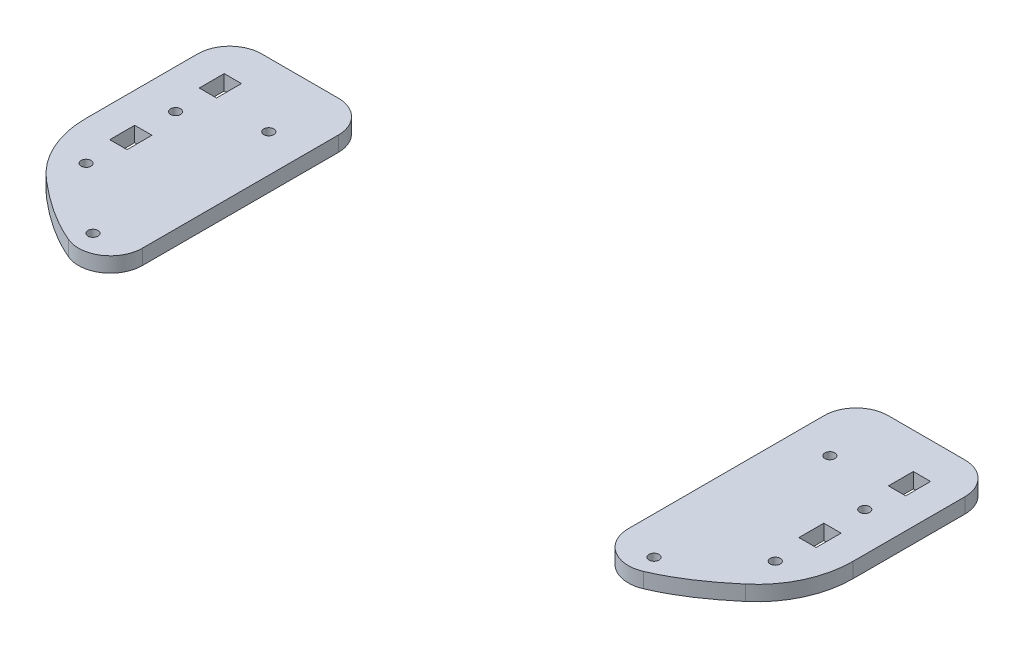
from build123d import *

# Parameters (mm, degrees)
SKETCH1_R        = 1.984375
SKETCH1_W        = 6.858
SKETCH1_H        = 9.906
EXTRUDE1_DEPTH   = 5.9944
EXTRUDE1_2_DEPTH = 5.9944
FILLET1_R        = 12.7
FILLET2_R        = 12.7
FILLET3_R        = 12.7
FILLET5_R        = 12.7
FILLET6_R        = 12.7
FILLET7_R        = 38.1
FILLET8_R        = 38.1
FILLET9_R        = 12.7


with BuildPart() as part:
    # Sketch1 → Extrude1 (new body)
    with BuildSketch(Plane(origin=(0, 0, 0), x_dir=(1, 0, 0), z_dir=(0, 1, 0))):
        with BuildLine():
            Line((38.251531685, 0), (-17.628468315, 0))
            Line((-17.628468315, 0), (-17.628468315, -74.142996555))
            add(Edge.make_bspline(
                [(-17.628468315, -74.142996555), (-7.183046663, -83.85534331), (9.286812039, -99.169323354), (30.494181461, -106.074935248), (38.251531685, -108.600908597)],
                knots=[0, 0, 0, 0, 0.634214406, 1, 1, 1, 1], degree=3))
            Line((38.251531685, -108.600908597), (38.251531685, 0))
        make_face()
        with Locations(Location((23.306531685, -95.25, 0), (0, 0, 270))):
            Circle(SKETCH1_R, mode=Mode.SUBTRACT)
        with Locations(Location((-2.134468315, -72.531002397, 0), (0, 0, 270))):
            Circle(SKETCH1_R, mode=Mode.SUBTRACT)
        with Locations((-2.134468315, -54.751002397)):
            Rectangle(SKETCH1_W, SKETCH1_H, mode=Mode.SUBTRACT)
        with Locations(Location((-2.134468315, -36.971002397, 0), (0, 0, 270))):
            Circle(SKETCH1_R, mode=Mode.SUBTRACT)
        with Locations(Location((23.306531685, -25.4, 0), (0, 0, 270))):
            Circle(SKETCH1_R, mode=Mode.SUBTRACT)
        with Locations((-2.134468315, -19.191002397)):
            Rectangle(SKETCH1_W, SKETCH1_H, mode=Mode.SUBTRACT)
    extrude(amount=-EXTRUDE1_DEPTH)

    # Fillet1
    fillet1_edges = [part.edges().sort_by_distance(p)[0] for p in [
        (-17.628468315, -2.9972, 0),
    ]]
    fillet(fillet1_edges, radius=FILLET1_R)

    # Fillet2
    fillet2_edges = [part.edges().sort_by_distance(p)[0] for p in [
        (38.251531685, -2.9972, 0),
    ]]
    fillet(fillet2_edges, radius=FILLET2_R)

    # Fillet6
    fillet6_edges = [part.edges().sort_by_distance(p)[0] for p in [
        (38.251531685, -2.9972, 108.600908597),
    ]]
    fillet(fillet6_edges, radius=FILLET6_R)

    # Fillet7
    fillet7_edges = [part.edges().sort_by_distance(p)[0] for p in [
        (-17.628468315, -2.9972, 74.142996555),
    ]]
    fillet(fillet7_edges, radius=FILLET7_R)


with BuildPart() as body_2:
    # Sketch1 → Extrude1 2 (new body)
    with BuildSketch(Plane(origin=(0, 0, 0), x_dir=(1, 0, 0), z_dir=(0, 1, 0))):
        with BuildLine():
            Line((287.171531685, 0), (231.291531685, 0))
            Line((231.291531685, 0), (231.291531685, -108.600908597))
            add(Edge.make_bspline(
                [(287.171531685, -74.142996555), (276.726110033, -83.85534331), (260.25625133, -99.169323354), (239.048881908, -106.074935248), (231.291531685, -108.600908597)],
                knots=[0, 0, 0, 0, 0.634214406, 1, 1, 1, 1], degree=3))
            Line((287.171531685, -74.142996555), (287.171531685, 0))
        make_face()
        with Locations(Location((246.236531685, -95.25, 0), (0, 0, 270))):
            Circle(SKETCH1_R, mode=Mode.SUBTRACT)
        with Locations(Location((271.677531685, -72.531002397, 0), (0, 0, 270))):
            Circle(SKETCH1_R, mode=Mode.SUBTRACT)
        with Locations((271.677531685, -54.751002397)):
            Rectangle(SKETCH1_W, SKETCH1_H, mode=Mode.SUBTRACT)
        with Locations(Location((246.236531685, -25.4, 0), (0, 0, 270))):
            Circle(SKETCH1_R, mode=Mode.SUBTRACT)
        with Locations(Location((271.677531685, -36.971002397, 0), (0, 0, 270))):
            Circle(SKETCH1_R, mode=Mode.SUBTRACT)
        with Locations((271.677531685, -19.191002397)):
            Rectangle(SKETCH1_W, SKETCH1_H, mode=Mode.SUBTRACT)
    extrude(amount=-EXTRUDE1_2_DEPTH)

    # Fillet3
    fillet3_edges = [body_2.edges().sort_by_distance(p)[0] for p in [
        (287.171531685, -2.9972, 0),
    ]]
    fillet(fillet3_edges, radius=FILLET3_R)

    # Fillet5
    fillet5_edges = [body_2.edges().sort_by_distance(p)[0] for p in [
        (231.291531685, -2.9972, 0),
    ]]
    fillet(fillet5_edges, radius=FILLET5_R)

    # Fillet8
    fillet8_edges = [body_2.edges().sort_by_distance(p)[0] for p in [
        (287.171531685, -2.9972, 74.142996555),
    ]]
    fillet(fillet8_edges, radius=FILLET8_R)

    # Fillet9
    fillet9_edges = [body_2.edges().sort_by_distance(p)[0] for p in [
        (231.291531685, -2.9972, 108.600908597),
    ]]
    fillet(fillet9_edges, radius=FILLET9_R)


solid = Compound([part.part, body_2.part])
